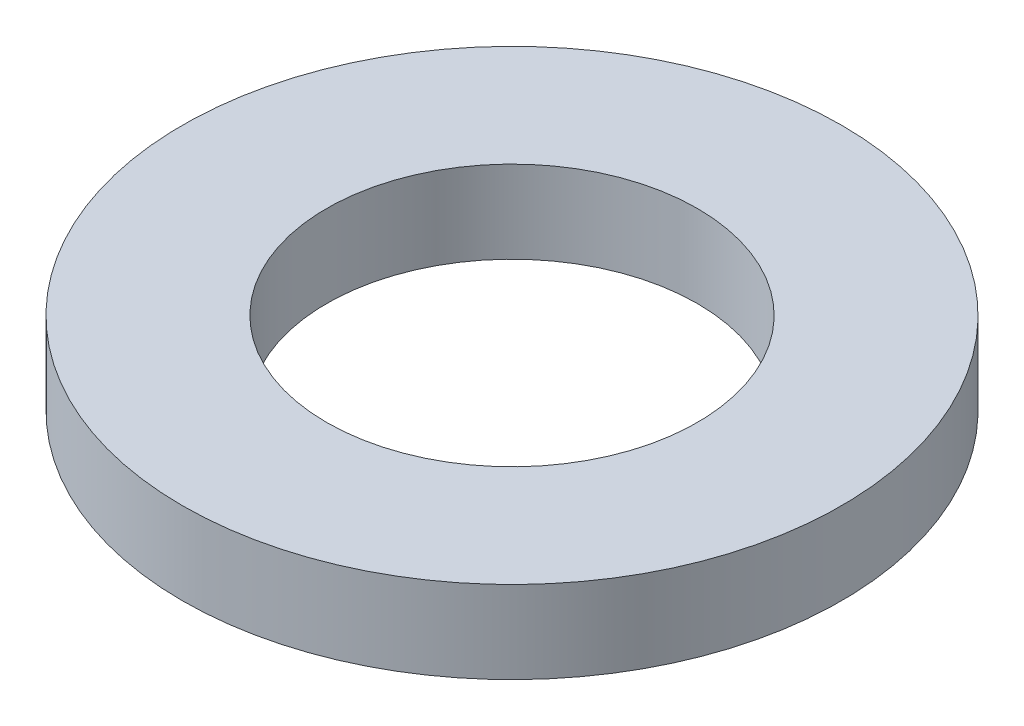
from build123d import *

# Parameters (mm, degrees)
SKETCH1_R           = 10.16
BOSS_EXTRUDE1_DEPTH = 2.54
SKETCH5_R           = 5.715
CUT_EXTRUDE1_DEPTH  = 15.591189122


with BuildPart() as part:
    # Sketch1 → Boss-Extrude1 (new body)
    with BuildSketch(Plane(origin=(0, 0, 0), x_dir=(1, 0, 0), z_dir=(0, 1, 0))):
        with Locations(Location((0, 0, 0), (0, 0, 270))):
            Circle(SKETCH1_R)
    extrude(amount=BOSS_EXTRUDE1_DEPTH)

    # Sketch5 → Cut-Extrude1 (cut, through all)
    with BuildSketch(Plane(origin=(0, 2.54, 0), x_dir=(-1, 0, 0), z_dir=(0, 1, 0))):
        with Locations(Location((0, 0, 0), (0, 0, 90))):
            Circle(SKETCH5_R)
    extrude(amount=-CUT_EXTRUDE1_DEPTH, mode=Mode.SUBTRACT)


solid = part.part
